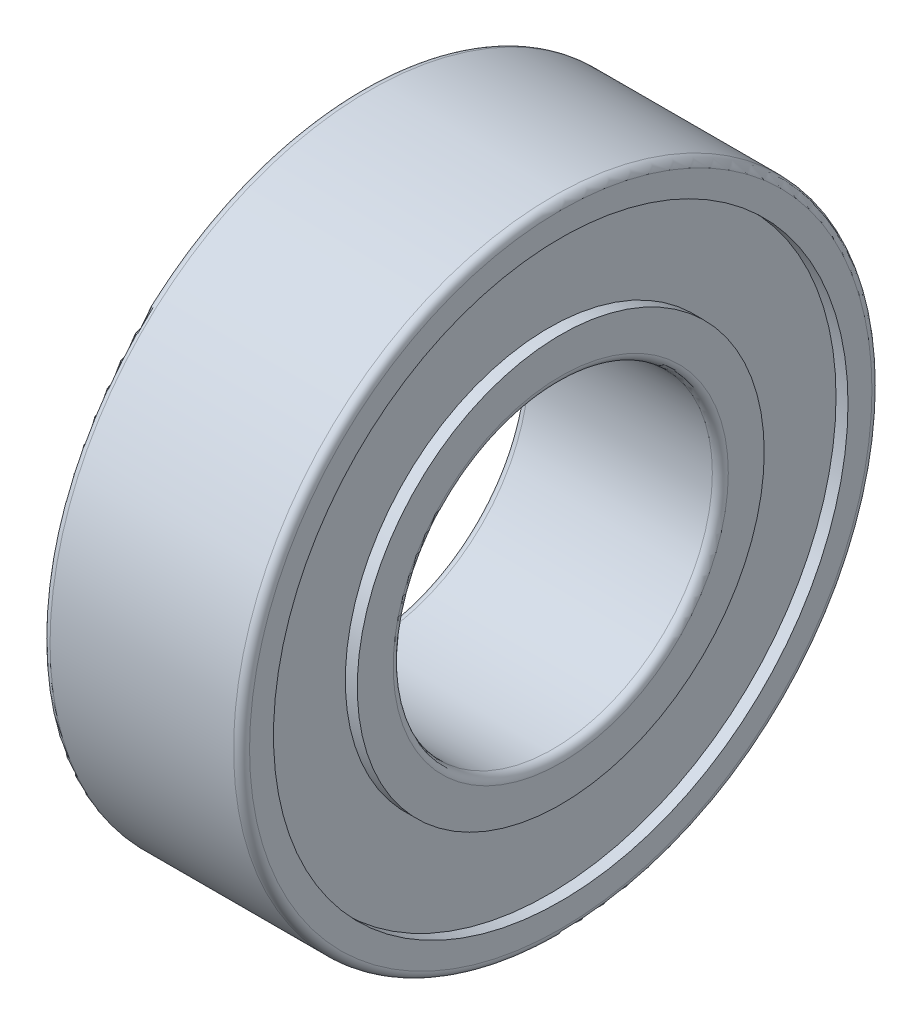
from build123d import *

# Parameters (mm, degrees)
FILLET1_R = 0.2


with BuildPart() as part:
    # Sketch1 → Revolve1 (revolve)
    with BuildSketch(Plane.XY, mode=Mode.PRIVATE) as revolve1_sk:
        Polygon((2.5, 4), (-2.5, 4), (-2.5, 5.1), (-2.2, 5.1), (-2.2, 7.2), (-2.5, 7.2), (-2.5, 8), (2.5, 8), (2.5, 7.2), (2.2, 7.2), (2.2, 5.1), (2.5, 5.1), align=None)
    revolve(revolve1_sk.sketch.rotate(Axis((0, 0, 0), (-1, 0, 0)), 90), axis=Axis((0, 0, 0), (-1, 0, 0)))

    # Fillet1
    fillet1_edges = [part.edges().sort_by_distance(p)[0] for p in [
        (2.5, 0, 8),
        (-2.5, 0, 8),
        (-2.5, 0, 4),
        (2.5, 0, 4),
    ]]
    fillet(fillet1_edges, radius=FILLET1_R)


solid = part.part
